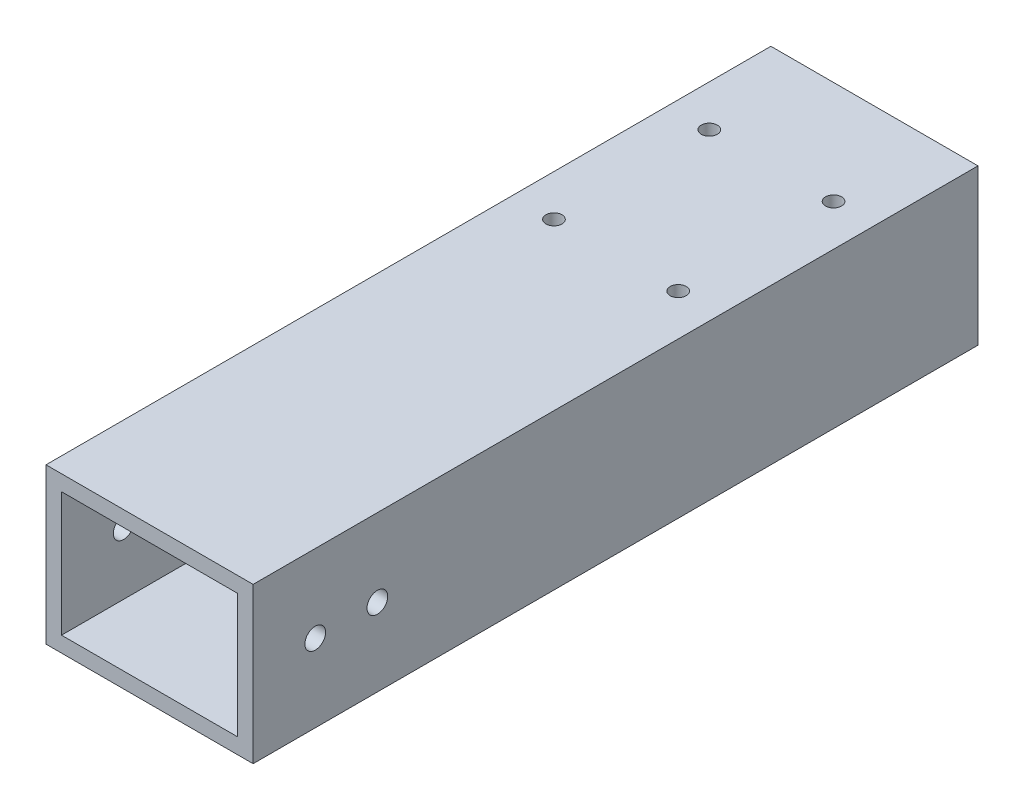
from build123d import *

# Parameters (mm, degrees)
SKETCH_1_W          = 40
SKETCH_1_H          = 30
SKETCH_1_W_2        = 34
SKETCH_1_H_2        = 24
EXTRUDE_1_DEPTH     = 140
SKETCH_2_R          = 2
CUT_EXTRUDE_1_DEPTH = 149.660687473
SKETCH_3_R          = 1.55
CUT_EXTRUDE_2_DEPTH = 149.660687473


with BuildPart() as part:
    # 草图1 → 凸台-拉伸1 (new body)
    with BuildSketch(Plane.XY):
        with Locations((20, 15)):
            Rectangle(SKETCH_1_W, SKETCH_1_H)
        with Locations((20, 15)):
            Rectangle(SKETCH_1_W_2, SKETCH_1_H_2, mode=Mode.SUBTRACT)
    extrude(amount=EXTRUDE_1_DEPTH)

    # 草图2 → 切除-拉伸1 (cut, through all)
    with BuildSketch(Plane(origin=(0, 0, 0), x_dir=(0, 0, -1), z_dir=(1, 0, 0))):
        with Locations(Location((-116, 15, 0), (0, 0, 180))):
            Circle(SKETCH_2_R)
        with Locations(Location((-128, 15, 0), (0, 0, 180))):
            Circle(SKETCH_2_R)
    extrude(amount=CUT_EXTRUDE_1_DEPTH, mode=Mode.SUBTRACT)

    # 草图3 → 切除-拉伸2 (cut, through all)
    with BuildSketch(Plane(origin=(0, 0, 0), x_dir=(1, 0, 0), z_dir=(0, 1, 0))):
        with Locations(Location((8, -19.9, 0), (0, 0, 90))):
            Circle(SKETCH_3_R)
        with Locations(Location((32, -19.9, 0), (0, 0, 90))):
            Circle(SKETCH_3_R)
        with Locations(Location((32, -49.9, 0), (0, 0, 90))):
            Circle(SKETCH_3_R)
        with Locations(Location((8, -49.9, 0), (0, 0, 90))):
            Circle(SKETCH_3_R)
    extrude(amount=CUT_EXTRUDE_2_DEPTH, mode=Mode.SUBTRACT)


solid = part.part
